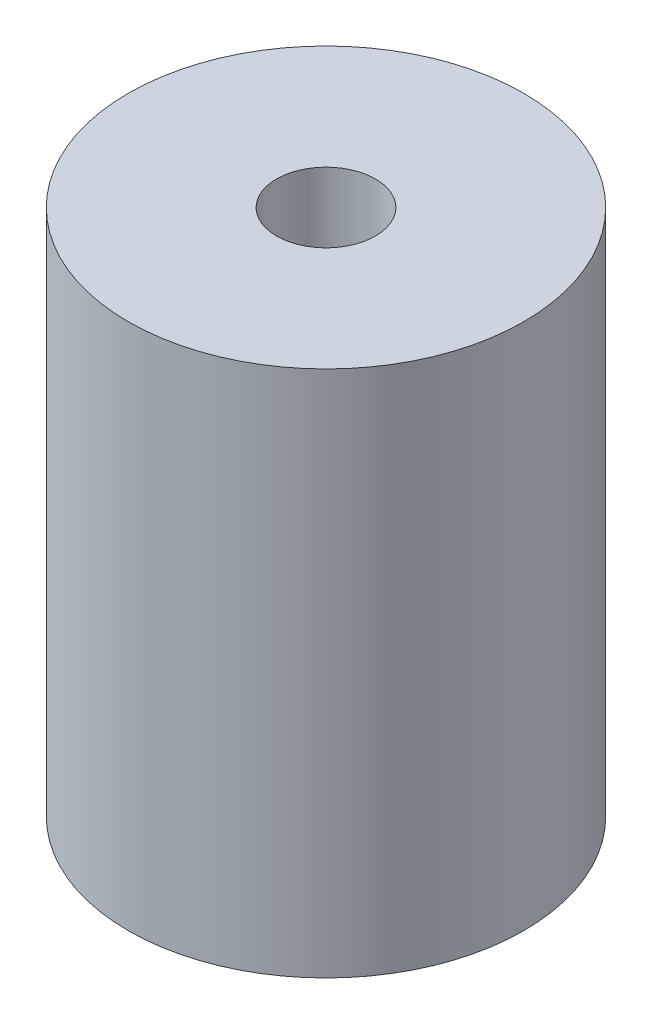
from build123d import *

# Parameters (mm, degrees)
SKETCH1_R           = 9.525
BOSS_EXTRUDE1_DEPTH = 25.4
SKETCH2_R           = 2.38125
CUT_EXTRUDE1_DEPTH  = 12.7
SKETCH3_R           = 3.175
CUT_EXTRUDE2_DEPTH  = 12.7


with BuildPart() as part:
    # Sketch1 → Boss-Extrude1 (new body)
    with BuildSketch(Plane(origin=(0, 0, 0), x_dir=(1, 0, 0), z_dir=(0, 1, 0))):
        with Locations(Location((0, 0, 0), (0, 0, 270))):
            Circle(SKETCH1_R)
    extrude(amount=BOSS_EXTRUDE1_DEPTH)

    # Sketch2 → Cut-Extrude1 (cut)
    with BuildSketch(Plane(origin=(0, 25.4, 0), x_dir=(1, 0, 0), z_dir=(0, 1, 0))):
        with Locations(Location((0, 0, 0), (0, 0, 270))):
            Circle(SKETCH2_R)
    extrude(amount=-CUT_EXTRUDE1_DEPTH, mode=Mode.SUBTRACT)

    # Sketch3 → Cut-Extrude2 (cut)
    with BuildSketch(Plane.XZ):
        with Locations(Location((0, 0, 0), (0, 0, 270))):
            Circle(SKETCH3_R)
    extrude(amount=-CUT_EXTRUDE2_DEPTH, mode=Mode.SUBTRACT)


solid = part.part
